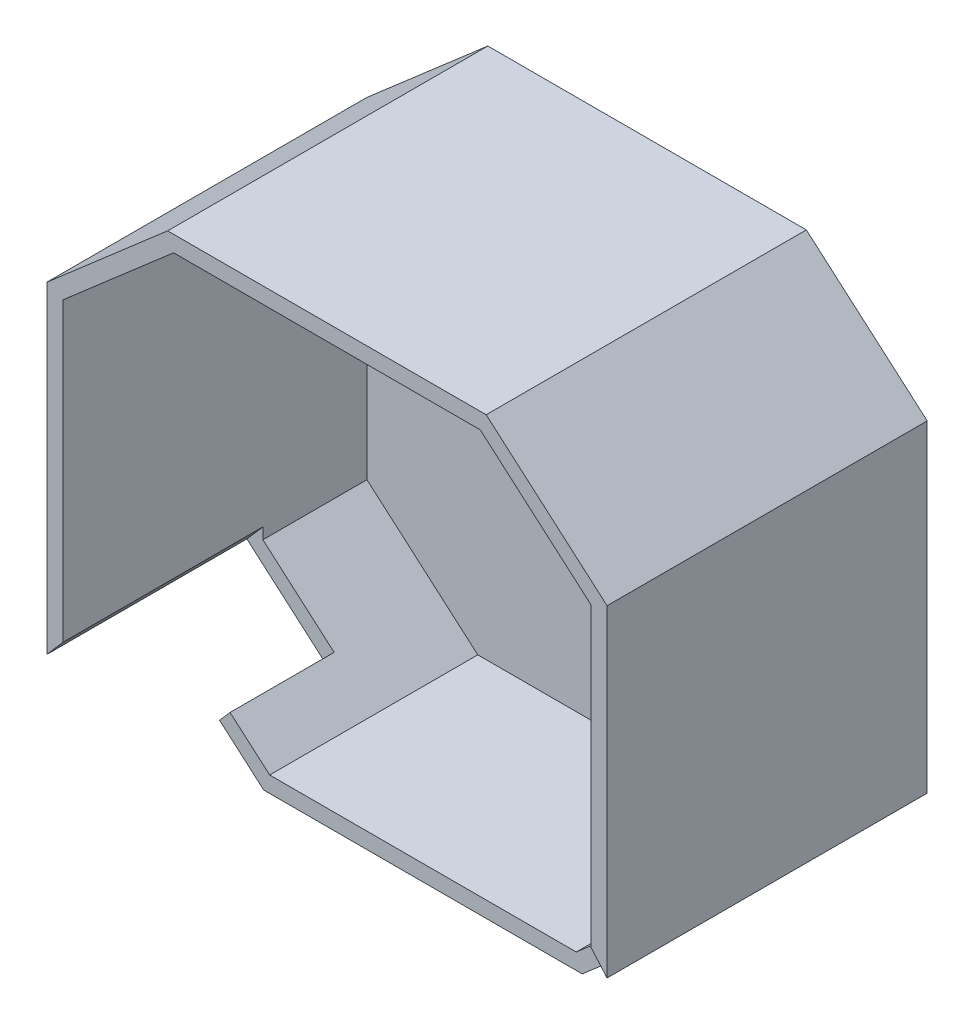
from build123d import *

# Parameters (mm, degrees)
BOSS_EXTRUDE1_DEPTH = 40
CUT_EXTRUDE1_REACH  = 97.146
SKETCH2_W           = 12.7
SKETCH2_H           = 36.204742391
CUT_EXTRUDE2_REACH  = 87.131
SKETCH3_W           = 56.49525371
SKETCH3_H           = 18.41246495
BOSS_EXTRUDE3_DEPTH = 2


with BuildPart() as part:
    # Sketch1 → Boss-Extrude1 (new body)
    with BuildSketch(Plane.XY):
        Polygon((-19.897004387, 33.25), (-35, 20.138954141), (-35, -20.138954141), (-19.897004387, -33.25), (19.897004387, -33.25), (35, -20.138954141), (35, 20.138954141), (19.897004387, 33.25), align=None)
        Polygon((19.15, 31.25), (33, 19.226690863), (33, -19.226690863), (19.15, -31.25), (-19.15, -31.25), (-33, -19.226690863), (-33, 19.226690863), (-19.15, 31.25), align=None, mode=Mode.SUBTRACT)
    extrude(amount=BOSS_EXTRUDE1_DEPTH)

    # Sketch2 → Cut-Extrude1 (cut, up to next)
    with BuildSketch(Plane(origin=(25.010799593, -28.810668547, 0), x_dir=(0.7551497806531032, 0.6555522929405175, 0), z_dir=(0.6555522929405175, -0.7551497806531032, 0)), mode=Mode.PRIVATE) as cut_extrude1_sk1:
        with Locations((6.878104758, 33.102371196)):
            Rectangle(SKETCH2_W, SKETCH2_H)
    cut_extrude1_tool1 = extrude(cut_extrude1_sk1.sketch, amount=-CUT_EXTRUDE1_REACH, mode=Mode.PRIVATE) & part.part
    cut_extrude1 = cut_extrude1_tool1.solids().sort_by_distance((30.204799, -24.301711, 33.102371))[0]
    add(cut_extrude1, mode=Mode.SUBTRACT)

    # Mirror1: Cut-Extrude1 across plane
    add(cut_extrude1.mirror(Plane(origin=(0, 0, 0), x_dir=(0, 0, 1), z_dir=(1, 0, 0))), mode=Mode.SUBTRACT)

    # Sketch3 → Cut-Extrude2 (cut, up to next)
    with BuildSketch(Plane.XZ.offset(33.25), mode=Mode.PRIVATE) as cut_extrude2_sk1:
        with Locations((-0.191025239, 37.206232475)):
            Rectangle(SKETCH3_W, SKETCH3_H)
    cut_extrude2_tool1 = extrude(cut_extrude2_sk1.sketch, amount=-CUT_EXTRUDE2_REACH, mode=Mode.PRIVATE) & part.part
    add(cut_extrude2_tool1.solids().sort_by_distance((-0.191025, -33.25, 37.206232))[0], mode=Mode.SUBTRACT)

    # Sketch4 → Boss-Extrude3 (add)
    with BuildSketch(Plane.XY):
        Polygon((19.15, 31.25), (33, 19.226690863), (33, -19.226690863), (19.15, -31.25), (-19.15, -31.25), (-33, -19.226690863), (-33, 19.226690863), (-19.15, 31.25), align=None)
    extrude(amount=BOSS_EXTRUDE3_DEPTH)


solid = part.part
